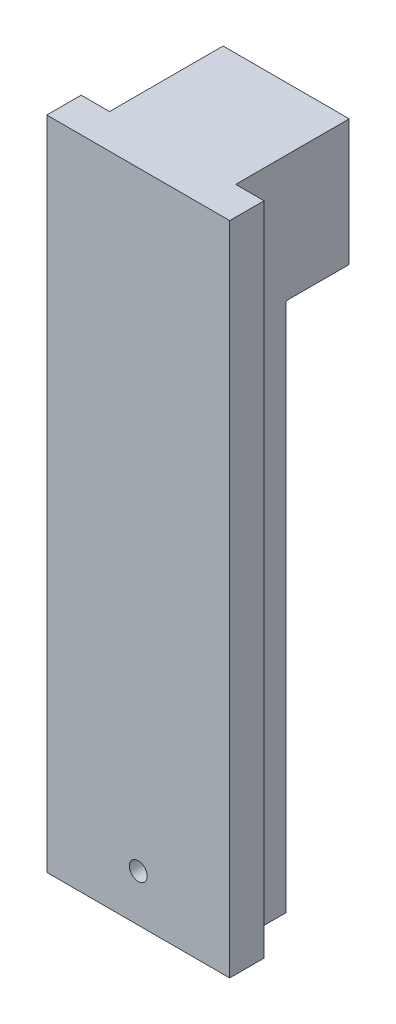
from build123d import *

# Parameters (mm, degrees)
DODANIE_WYCI_GNI_CIE1_DEPTH = 104
SZKIC2_W                    = 20
SZKIC2_H                    = 20
DODANIE_WYCI_GNI_CIE2_DEPTH = 10
SZKIC3_R                    = 2.5
WYTNIJ_WYCI_GNI_CIE1_DEPTH  = 10
SZKIC4_R                    = 1.425
WYTNIJ_WYCI_GNI_CIE2_DEPTH  = 108.592529945


with BuildPart() as part:
    # Szkic1 → Dodanie-wyciągnięcie1 (new body)
    with BuildSketch(Plane(origin=(0, 0, 0), x_dir=(1, 0, 0), z_dir=(0, 1, 0))):
        Polygon((-14.5, 0), (14.5, 0), (14.5, 5.45), (10, 5.45), (10, 13.45), (-10, 13.45), (-10, 5.45), (-14.5, 5.45), align=None)
    extrude(amount=DODANIE_WYCI_GNI_CIE1_DEPTH)

    # Szkic2 → Dodanie-wyciągnięcie2 (add)
    with BuildSketch(Plane(origin=(0, 0, -13.45), x_dir=(-1, 0, 0), z_dir=(0, 0, -1))):
        with Locations((0, 94)):
            Rectangle(SZKIC2_W, SZKIC2_H)
    extrude(amount=DODANIE_WYCI_GNI_CIE2_DEPTH)

    # Szkic3 → Wytnij-wyciągnięcie1 (cut)
    with BuildSketch(Plane(origin=(0, 0, -23.45), x_dir=(-1, 0, 0), z_dir=(0, 0, -1))):
        with Locations((0, 94)):
            Circle(SZKIC3_R)
    extrude(amount=-WYTNIJ_WYCI_GNI_CIE1_DEPTH, mode=Mode.SUBTRACT)

    # Szkic4 → Wytnij-wyciągnięcie2 (cut, through all)
    with BuildSketch(Plane.XY):
        with Locations((0, 7.425)):
            Circle(SZKIC4_R)
    extrude(amount=-WYTNIJ_WYCI_GNI_CIE2_DEPTH, mode=Mode.SUBTRACT)


solid = part.part
